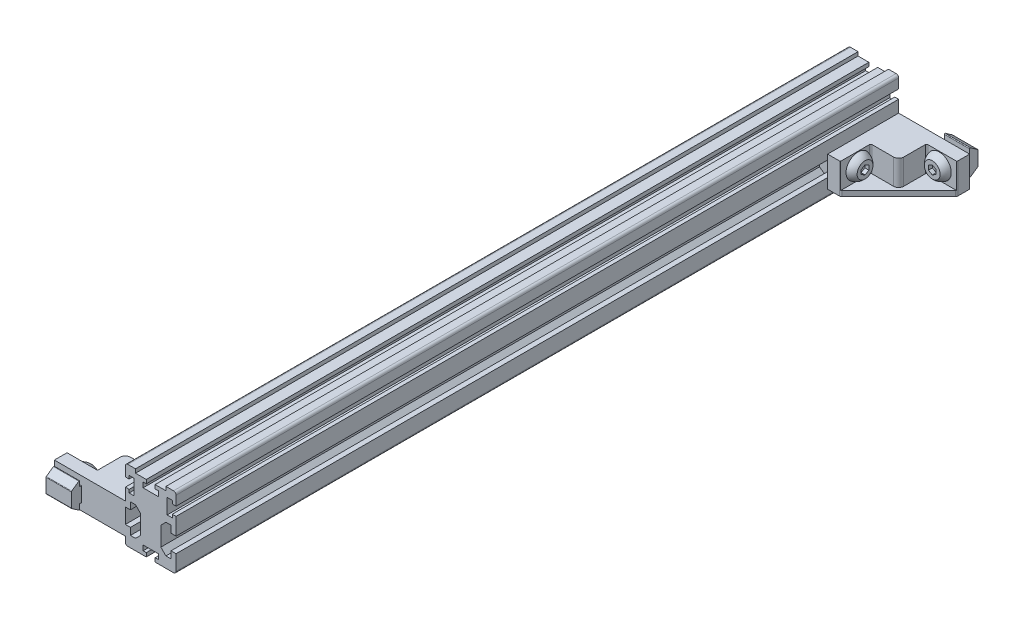
from build123d import *

# Parameters (mm, degrees)
BOSS_EXTRUDE1_DEPTH      = 285
BOSS_EXTRUDE2_START      = -7
BOSS_EXTRUDE2_DEPTH      = 12
CUT_EXTRUDE1_DEPTH       = 10
CUT_EXTRUDE2_DEPTH       = 1.56
BOSS_EXTRUDE3_DEPTH      = 5
CIRPATTERN1_COUNT        = 2
CIRPATTERN1_ANGLE        = 90
CIRPATTERN2_COUNT        = 2
CIRPATTERN2_ANGLE        = 180
CIRPATTERN2_COPY_2_DEPTH = 1.56
CIRPATTERN2_COPY_3_DEPTH = 5


with BuildPart() as part:
    # Sketch1 → Boss-Extrude1 (new body)
    with BuildSketch(Plane(origin=(24, 0, 0), x_dir=(-1, 0, 0), z_dir=(0, 0, -1))):
        with BuildLine():
            Line((14, 13), (14, 9.25))
            Line((14, 9.25), (15.5, 9.25))
            Line((15.5, 9.25), (15.5, 10.5))
            Line((15.5, 10.5), (17.5, 10.5))
            Line((17.5, 10.5), (17.5, 4.5))
            Line((17.5, 4.5), (15.5, 4.5))
            Line((15.5, 4.5), (15.5, 5.75))
            Line((15.5, 5.75), (14, 5.75))
            Line((14, 5.75), (14, -1))
            Line((14, -1), (16, -1))
            Line((16, -1), (16, 1.75))
            Line((16, 1.75), (18, 1.75))
            Line((18, 1.75), (20, -0.25))
            Line((20, -0.25), (20, -7.75))
            Line((20, -7.75), (18, -9.75))
            Line((18, -9.75), (16, -9.75))
            Line((16, -9.75), (16, -7))
            Line((16, -7), (14, -7))
            Line((14, -7), (14, -13))
            ThreePointArc((14, -13), (14.292893219, -13.707106781), (15, -14))
            Line((15, -14), (22.25, -14))
            Line((22.25, -14), (22.25, -12.5))
            Line((22.25, -12.5), (21, -12.5))
            Line((21, -12.5), (21, -10.5))
            Line((21, -10.5), (27, -10.5))
            Line((27, -10.5), (27, -12.5))
            Line((27, -12.5), (25.75, -12.5))
            Line((25.75, -12.5), (25.75, -14))
            Line((25.75, -14), (33, -14))
            ThreePointArc((33, -14), (33.707106781, -13.707106781), (34, -13))
            Line((34, -13), (34, -7))
            Line((34, -7), (32, -7))
            Line((32, -7), (32, -9.75))
            Line((32, -9.75), (30, -9.75))
            Line((30, -9.75), (28, -7.75))
            Line((28, -7.75), (28, -0.25))
            Line((28, -0.25), (30, 1.75))
            Line((30, 1.75), (32, 1.75))
            Line((32, 1.75), (32, -1))
            Line((32, -1), (34, -1))
            Line((34, -1), (34, 5.75))
            Line((34, 5.75), (32.5, 5.75))
            Line((32.5, 5.75), (32.5, 4.5))
            Line((32.5, 4.5), (30.5, 4.5))
            Line((30.5, 4.5), (30.5, 10.5))
            Line((30.5, 10.5), (32.5, 10.5))
            Line((32.5, 10.5), (32.5, 9.25))
            Line((32.5, 9.25), (34, 9.25))
            Line((34, 9.25), (34, 13))
            ThreePointArc((34, 13), (33.707106781, 13.707106781), (33, 14))
            Line((33, 14), (30, 14))
            Line((30, 14), (30, 12.5))
            Line((30, 12.5), (25.75, 12.5))
            Line((25.75, 12.5), (25.75, 11))
            Line((25.75, 11), (27, 11))
            Line((27, 11), (27, 9))
            Line((27, 9), (21, 9))
            Line((21, 9), (21, 11))
            Line((21, 11), (22.25, 11))
            Line((22.25, 11), (22.25, 12.5))
            Line((22.25, 12.5), (18, 12.5))
            Line((18, 12.5), (18, 14))
            Line((18, 14), (15, 14))
            ThreePointArc((15, 14), (14.292893219, 13.707106781), (14, 13))
        make_face()
    extrude(amount=BOSS_EXTRUDE1_DEPTH)

    # Sketch2 → Boss-Extrude2 (add)
    with BuildSketch(Plane(origin=(0, -4, 0), x_dir=(1, 0, 0), z_dir=(0, 1, 0)).offset(BOSS_EXTRUDE2_START)):
        with BuildLine():
            Line((38, 280.414213562), (38, 285))
            Line((38, 285), (10, 285))
            Line((10, 285), (10, 257))
            Line((10, 257), (14.585786438, 257))
            ThreePointArc((14.585786438, 257), (14.96846987, 257.076120467), (15.292893219, 257.292893219))
            Line((15.292893219, 257.292893219), (37.707106781, 279.707106781))
            ThreePointArc((37.707106781, 279.707106781), (37.923879533, 280.03153013), (38, 280.414213562))
        make_face()
    boss_extrude2 = extrude(amount=BOSS_EXTRUDE2_DEPTH)

    # Sketch3 → Cut-Extrude1 (cut)
    with BuildSketch(Plane(origin=(0, 1, 0), x_dir=(1, 0, 0), z_dir=(0, 1, 0))):
        with BuildLine():
            Line((15, 257), (38, 280))
            Line((38, 280), (26.5, 280))
            ThreePointArc((26.5, 280), (26.146446609, 279.853553391), (26, 279.5))
            Line((26, 279.5), (26, 271))
            ThreePointArc((26, 271), (25.414213562, 269.585786438), (24, 269))
            Line((24, 269), (15.5, 269))
            ThreePointArc((15.5, 269), (15.146446609, 268.853553391), (15, 268.5))
            Line((15, 268.5), (15, 257))
        make_face()
    cut_extrude1 = extrude(amount=-CUT_EXTRUDE1_DEPTH, mode=Mode.SUBTRACT)

    # Sketch4 → Revolve1 (revolve)
    with BuildSketch(Plane(origin=(31, 0, 0), x_dir=(0, 0, -1), z_dir=(1, 0, 0))):
        with BuildLine():
            Line((290, -4), (290, -1.5))
            Line((290, -1.5), (280, -1.5))
            Line((280, -1.5), (280, 0.75))
            ThreePointArc((280, 0.75), (278.484308853, 0.17559271), (277.25, -0.875))
            Line((277.25, -0.875), (277.25, -4))
            Line((277.25, -4), (290, -4))
        make_face()
    revolve1 = revolve(axis=Axis((31, -4, -290), (0, 0, 1)))

    # Sketch5 → Cut-Extrude2 (cut)
    with BuildSketch(Plane.XY.offset(-277.25)):
        Polygon((31, -2.267949192), (29.5, -3.133974596), (29.5, -4.866025404), (31, -5.732050808), (32.5, -4.866025404), (32.5, -3.133974596), align=None)
    cut_extrude2 = extrude(amount=-CUT_EXTRUDE2_DEPTH, mode=Mode.SUBTRACT)

    # Sketch6 → Boss-Extrude3 (add, symmetric)
    with BuildSketch(Plane(origin=(31, 0, 0), x_dir=(0, 0, -1), z_dir=(1, 0, 0))):
        with BuildLine():
            Line((286.2, -1.3), (286.2, -6.7))
            ThreePointArc((286.2, -6.7), (286.258578644, -6.841421356), (286.4, -6.9))
            Line((286.4, -6.9), (287, -6.9))
            Line((287, -6.9), (287, -8.768858987))
            ThreePointArc((287, -8.768858987), (287.123797819, -8.972871479), (287.36192258, -8.957263957))
            Line((287.36192258, -8.957263957), (290.172072931, -6.989575498))
            ThreePointArc((290.172072931, -6.989575498), (290.26610325, -6.882354469), (290.3, -6.743829885))
            Line((290.3, -6.743829885), (290.3, -1.256170115))
            ThreePointArc((290.3, -1.256170115), (290.26610325, -1.117645531), (290.172072931, -1.010424502))
            Line((290.172072931, -1.010424502), (287.36192258, 0.957263957))
            ThreePointArc((287.36192258, 0.957263957), (287.123797819, 0.972871479), (287, 0.768858987))
            Line((287, 0.768858987), (287, -1.1))
            Line((287, -1.1), (286.4, -1.1))
            ThreePointArc((286.4, -1.1), (286.258578644, -1.158578644), (286.2, -1.3))
        make_face()
    boss_extrude3 = extrude(amount=BOSS_EXTRUDE3_DEPTH, both=True)

    # CirPattern1: Revolve1, Cut-Extrude2, Boss-Extrude3 ×2 about axis
    cirpattern1_axis = Axis((31, 15.4, -264), (0, 1, 0))
    add([revolve1.rotate(cirpattern1_axis, i * CIRPATTERN1_ANGLE / (CIRPATTERN1_COUNT - 1)) for i in range(1, CIRPATTERN1_COUNT)])
    add([cut_extrude2.rotate(cirpattern1_axis, i * CIRPATTERN1_ANGLE / (CIRPATTERN1_COUNT - 1)) for i in range(1, CIRPATTERN1_COUNT)], mode=Mode.SUBTRACT)
    add([boss_extrude3.rotate(cirpattern1_axis, i * CIRPATTERN1_ANGLE / (CIRPATTERN1_COUNT - 1)) for i in range(1, CIRPATTERN1_COUNT)])

    # CirPattern2: Boss-Extrude2, Cut-Extrude1, Revolve1, Cut-Extrude2, Boss-Extrude3 ×2 about axis
    cirpattern2_axis = Axis((0, 15.4, -142.5), (0, -1, 0))
    add([boss_extrude2.rotate(cirpattern2_axis, i * CIRPATTERN2_ANGLE / (CIRPATTERN2_COUNT - 1)) for i in range(1, CIRPATTERN2_COUNT)])
    add([cut_extrude1.rotate(cirpattern2_axis, i * CIRPATTERN2_ANGLE / (CIRPATTERN2_COUNT - 1)) for i in range(1, CIRPATTERN2_COUNT)], mode=Mode.SUBTRACT)
    add([revolve1.rotate(cirpattern2_axis, i * CIRPATTERN2_ANGLE / (CIRPATTERN2_COUNT - 1)) for i in range(1, CIRPATTERN2_COUNT)])
    add([cut_extrude2.rotate(cirpattern2_axis, i * CIRPATTERN2_ANGLE / (CIRPATTERN2_COUNT - 1)) for i in range(1, CIRPATTERN2_COUNT)], mode=Mode.SUBTRACT)
    add([boss_extrude3.rotate(cirpattern2_axis, i * CIRPATTERN2_ANGLE / (CIRPATTERN2_COUNT - 1)) for i in range(1, CIRPATTERN2_COUNT)])

    # CirPattern2 copy 1 sketch → CirPattern2 copy 1 (revolve)
    with BuildSketch(Plane(origin=(-295, 0, -21), x_dir=(1, 0, 0), z_dir=(0, 0, 1))):
        with BuildLine():
            Line((290, -4), (290, -1.5))
            Line((290, -1.5), (280, -1.5))
            Line((280, -1.5), (280, 0.75))
            ThreePointArc((280, 0.75), (278.484308853, 0.17559271), (277.25, -0.875))
            Line((277.25, -0.875), (277.25, -4))
            Line((277.25, -4), (290, -4))
        make_face()
    revolve(axis=Axis((-5, -4, -21), (-1, 0, 0)))

    # CirPattern2 copy 2 sketch → CirPattern2 copy 2 (cut)
    with BuildSketch(Plane(origin=(-17.75, 0, -52), x_dir=(0, 0, 1), z_dir=(-1, 0, 0))):
        Polygon((31, -2.267949192), (29.5, -3.133974596), (29.5, -4.866025404), (31, -5.732050808), (32.5, -4.866025404), (32.5, -3.133974596), align=None)
    extrude(amount=-CIRPATTERN2_COPY_2_DEPTH, mode=Mode.SUBTRACT)

    # CirPattern2 copy 3 sketch → CirPattern2 copy 3 (add, symmetric)
    with BuildSketch(Plane(origin=(-295, 0, -21), x_dir=(1, 0, 0), z_dir=(0, 0, 1))):
        with BuildLine():
            Line((286.2, -1.3), (286.2, -6.7))
            ThreePointArc((286.2, -6.7), (286.258578644, -6.841421356), (286.4, -6.9))
            Line((286.4, -6.9), (287, -6.9))
            Line((287, -6.9), (287, -8.768858987))
            ThreePointArc((287, -8.768858987), (287.123797819, -8.972871479), (287.36192258, -8.957263957))
            Line((287.36192258, -8.957263957), (290.172072931, -6.989575498))
            ThreePointArc((290.172072931, -6.989575498), (290.26610325, -6.882354469), (290.3, -6.743829885))
            Line((290.3, -6.743829885), (290.3, -1.256170115))
            ThreePointArc((290.3, -1.256170115), (290.26610325, -1.117645531), (290.172072931, -1.010424502))
            Line((290.172072931, -1.010424502), (287.36192258, 0.957263957))
            ThreePointArc((287.36192258, 0.957263957), (287.123797819, 0.972871479), (287, 0.768858987))
            Line((287, 0.768858987), (287, -1.1))
            Line((287, -1.1), (286.4, -1.1))
            ThreePointArc((286.4, -1.1), (286.258578644, -1.158578644), (286.2, -1.3))
        make_face()
    extrude(amount=CIRPATTERN2_COPY_3_DEPTH, both=True)


solid = part.part
